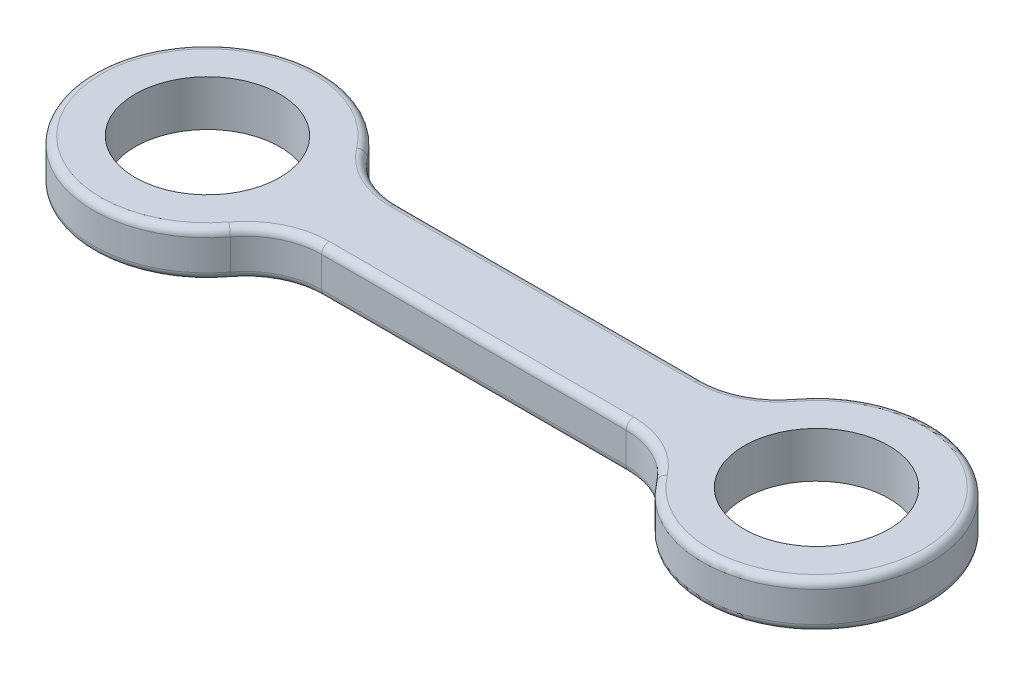
from build123d import *

# Parameters (mm, degrees)
SKETCH1_R           = 9.5
BOSS_EXTRUDE1_DEPTH = 6
FILLET1_R           = 1


with BuildPart() as part:
    # Sketch1 → Boss-Extrude1 (new body)
    with BuildSketch(Plane(origin=(0, 0, 0), x_dir=(1, 0, 0), z_dir=(0, 1, 0))):
        with BuildLine():
            Line((-28.045977011, 5), (11.954022989, 5))
            ThreePointArc((11.954022989, 5), (16.426158944, 6.05572809), (19.954022989, 9))
            ThreePointArc((19.954022989, 9), (46.954022989, 0), (19.954022989, -9))
            ThreePointArc((19.954022989, -9), (16.426158944, -6.05572809), (11.954022989, -5))
            Line((11.954022989, -5), (-28.045977011, -5))
            ThreePointArc((-28.045977011, -5), (-32.518112966, -6.05572809), (-36.045977011, -9))
            ThreePointArc((-36.045977011, -9), (-63.045977011, 0), (-36.045977011, 9))
            ThreePointArc((-36.045977011, 9), (-32.518112966, 6.05572809), (-28.045977011, 5))
        make_face()
        with Locations(Location((-48.045977011, 0, 0), (0, 0, 270))):
            Circle(SKETCH1_R, mode=Mode.SUBTRACT)
        with Locations(Location((31.954022989, 0, 0), (0, 0, 270))):
            Circle(SKETCH1_R, mode=Mode.SUBTRACT)
    extrude(amount=BOSS_EXTRUDE1_DEPTH)

    # Fillet1
    fillet1_edges = [part.edges().sort_by_distance(p)[0] for p in [
        (-63.045977011, 0, 0),
        (-32.518112966, 0, -6.05572809),
        (-8.045977011, 0, -5),
        (16.426158944, 0, -6.05572809),
        (-32.518112966, 6, -6.05572809),
        (-63.045977011, 6, 0),
        (-32.518112966, 6, 6.05572809),
        (-8.045977011, 6, 5),
        (16.426158944, 6, 6.05572809),
        (46.954022989, 6, 0),
        (16.426158944, 6, -6.05572809),
        (46.954022989, 0, 0),
        (-8.045977011, 6, -5),
        (16.426158944, 0, 6.05572809),
        (-8.045977011, 0, 5),
        (-32.518112966, 0, 6.05572809),
    ]]
    fillet(fillet1_edges, radius=FILLET1_R)


solid = part.part
